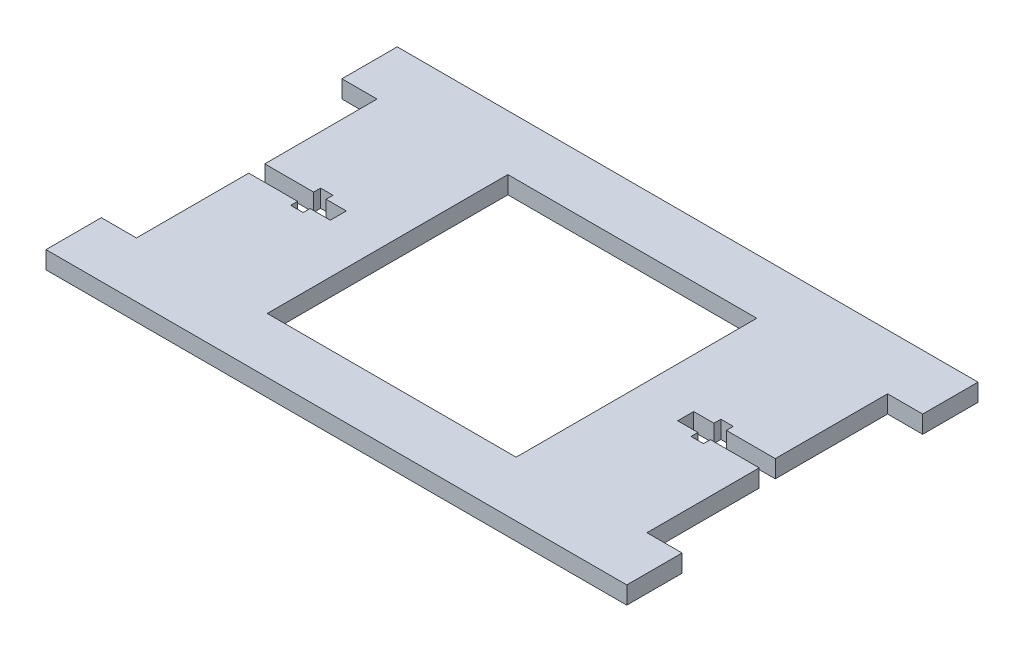
from build123d import *

# Parameters (mm, degrees)
SKETCH1_W      = 45
SKETCH1_H      = 43.5
EXTRUDE1_DEPTH = 3.175


with BuildPart() as part:
    # Sketch1 → Extrude1 (new body)
    with BuildSketch(Plane(origin=(0, 0, 0), x_dir=(1, 0, 0), z_dir=(0, 1, 0))):
        Polygon((37.227457893, -45.375264395), (37.227457893, -35.375264395), (30.877457893, -35.375264395), (30.877457893, -15.075264395), (22.037457893, -15.075264395), (22.037457893, -16.325264395), (19.787457893, -16.325264395), (19.787457893, -15.075264395), (16.127457893, -15.075264395), (16.127457893, -12.175264395), (19.787457893, -12.175264395), (19.787457893, -10.925264395), (22.037457893, -10.925264395), (22.037457893, -12.175264395), (30.877457893, -12.175264395), (30.877457893, 8.124735605), (37.227457893, 8.124735605), (37.227457893, 18.124735605), (-67.772542107, 18.124735605), (-67.772542107, 8.124735605), (-61.422542107, 8.124735605), (-61.422542107, -12.175264395), (-52.582542107, -12.175264395), (-52.582542107, -10.925264395), (-50.332542107, -10.925264395), (-50.332542107, -12.175264395), (-46.672542107, -12.175264395), (-46.672542107, -15.075264395), (-50.332542107, -15.075264395), (-50.332542107, -16.325264395), (-52.582542107, -16.325264395), (-52.582542107, -15.075264395), (-61.422542107, -15.075264395), (-61.422542107, -35.375264395), (-67.772542107, -35.375264395), (-67.772542107, -45.375264395), align=None)
        with Locations((-15.272542107, -13.625264395)):
            Rectangle(SKETCH1_W, SKETCH1_H, mode=Mode.SUBTRACT)
    extrude(amount=EXTRUDE1_DEPTH)


solid = part.part
